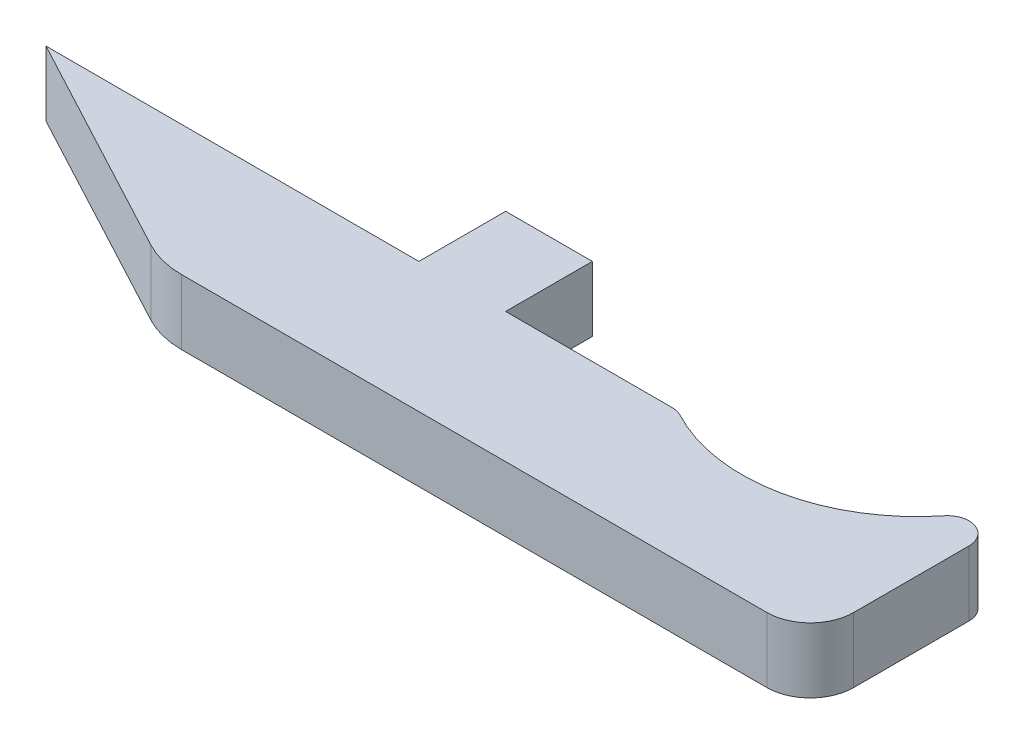
from build123d import *

# Parameters (mm, degrees)
BOSS_EXTRUDE1_DEPTH = 4.7625
FILLET1_R           = 1.5875
FILLET2_R           = 6.35
FILLET3_R           = 3.175
SKETCH2_W           = 6.35
SKETCH2_H           = 4.7625
BOSS_EXTRUDE2_DEPTH = 6.35


with BuildPart() as part:
    # Sketch1 → Boss-Extrude1 (new body)
    with BuildSketch(Plane(origin=(0, 0, 0), x_dir=(1, 0, 0), z_dir=(0, 1, 0))):
        with BuildLine():
            Line((52.558738922, -45.868730992), (33.5895, -45.868730992))
            Line((33.5895, -45.868730992), (6.2845, -45.868730992))
            Line((6.2845, -45.868730992), (24.145239996, -55.393730992))
            Line((24.145239996, -55.393730992), (71.770239996, -55.393730992))
            Line((71.770239996, -55.393730992), (71.770239996, -34.743530992))
            ThreePointArc((71.770239996, -34.743530992), (65.371223106, -45.84366442), (52.558738922, -45.868730992))
        make_face()
    extrude(amount=BOSS_EXTRUDE1_DEPTH)

    # Fillet1
    fillet1_edges = [part.edges().sort_by_distance(p)[0] for p in [
        (71.770239996, 2.38125, 34.743530992),
        (52.558738922, 2.38125, 45.868730992),
    ]]
    fillet(fillet1_edges, radius=FILLET1_R)

    # Fillet2
    fillet2_edges = [part.edges().sort_by_distance(p)[0] for p in [
        (24.145239996, 2.38125, 55.393730992),
    ]]
    fillet(fillet2_edges, radius=FILLET2_R)

    # Fillet3
    fillet3_edges = [part.edges().sort_by_distance(p)[0] for p in [
        (71.770239996, 2.38125, 55.393730992),
    ]]
    fillet(fillet3_edges, radius=FILLET3_R)

    # Sketch2 → Boss-Extrude2 (add)
    with BuildSketch(Plane(origin=(0, 0, 45.868730992), x_dir=(-1, 0, 0), z_dir=(0, 0, -1))):
        with Locations((-36.7645, 2.38125)):
            Rectangle(SKETCH2_W, SKETCH2_H)
    extrude(amount=BOSS_EXTRUDE2_DEPTH)


solid = part.part
